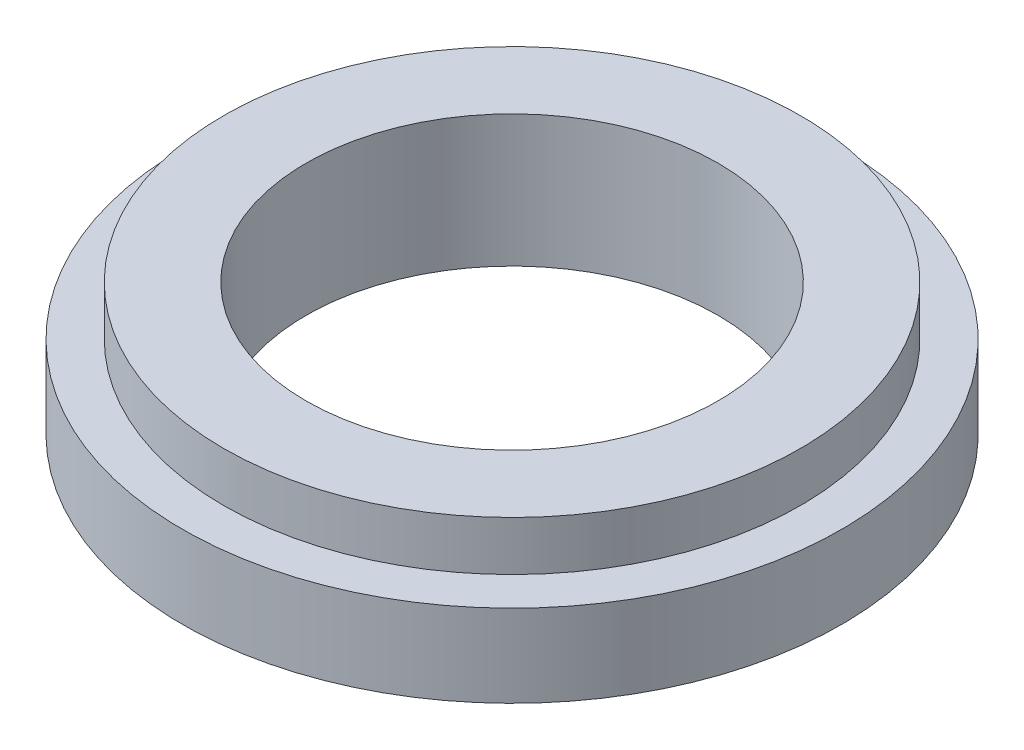
from build123d import *
from build123d.topology import SkipClean

# Parameters (mm, degrees)
SKETCH1_R           = 17.5
SKETCH1_R_2         = 12.5
BOSS_EXTRUDE1_DEPTH = 3
BOSS_EXTRUDE2_START = 5
SKETCH2_R           = 20
SKETCH2_R_2         = 12.5
BOSS_EXTRUDE2_DEPTH = 5


with BuildPart() as part:
    # Sketch1 → Boss-Extrude1 (new body)
    with BuildSketch(Plane(origin=(0, 0, 0), x_dir=(1, 0, 0), z_dir=(0, 1, 0))):
        with Locations(Location((0, 0, 0), (0, 0, 270))):
            Circle(SKETCH1_R)
        with Locations(Location((0, 0, 0), (0, 0, 270))):
            Circle(SKETCH1_R_2, mode=Mode.SUBTRACT)
    extrude(amount=BOSS_EXTRUDE1_DEPTH)

    # Sketch2 → Boss-Extrude2 (add)
    with SkipClean():  # the faces are left unmerged after this step: merging them gives an invalid solid
        with BuildSketch(Plane.XZ.offset(BOSS_EXTRUDE2_START)):
            with Locations(Location((0, 0, 0), (0, 0, 270))):
                Circle(SKETCH2_R)
            with Locations(Location((0, 0, 0), (0, 0, 270))):
                Circle(SKETCH2_R_2, mode=Mode.SUBTRACT)
        extrude(amount=-BOSS_EXTRUDE2_DEPTH)


solid = part.part
